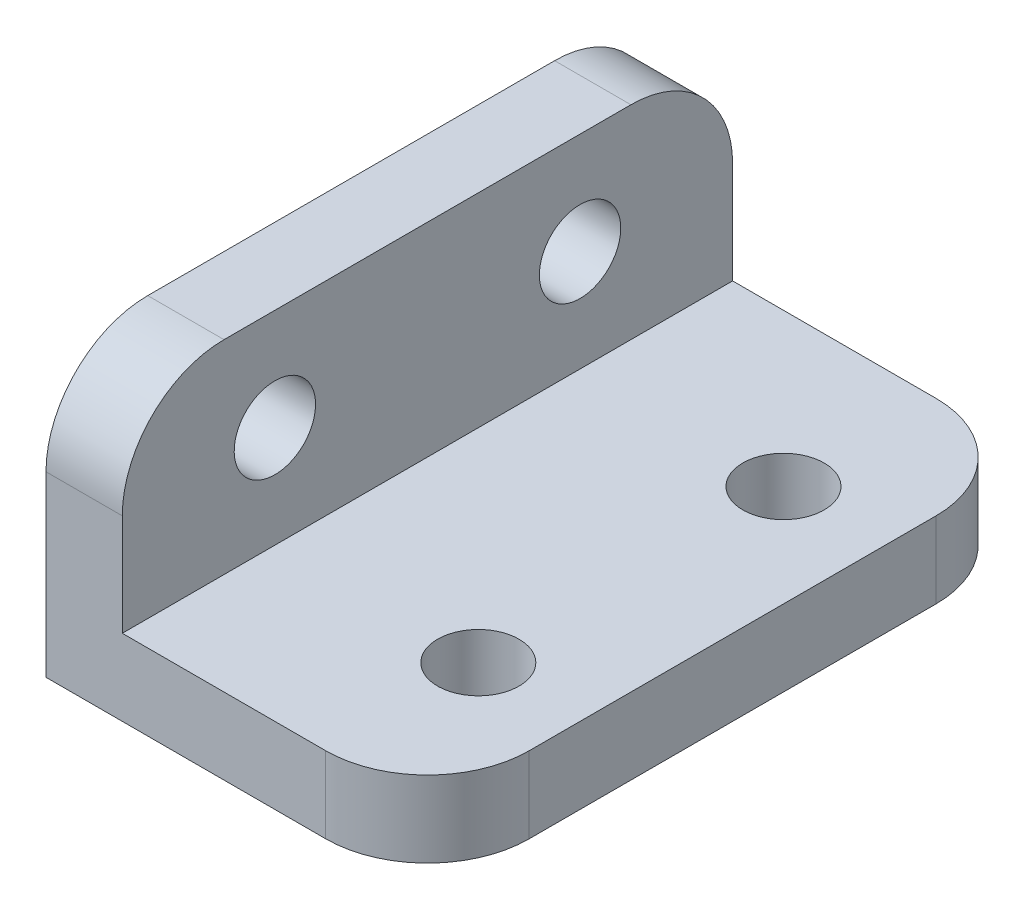
from build123d import *

# Parameters (mm, degrees)
EXTRUDE_1_DEPTH     = 24
SKETCH_2_R          = 1.6
CUT_EXTRUDE_1_DEPTH = 24
SKETCH_3_R          = 1.6
CUT_EXTRUDE_2_DEPTH = 24
FILLET_1_R          = 4


with BuildPart() as part:
    # 草图1 → 凸台-拉伸1 (new body)
    with BuildSketch(Plane.XY):
        Polygon((6, 112.691622655), (3, 112.691622655), (3, 101.691622655), (18, 101.691622655), (18, 104.691622655), (6, 104.691622655), align=None)
    extrude(amount=-EXTRUDE_1_DEPTH)

    # 草图2 → 切除-拉伸1 (cut)
    with BuildSketch(Plane(origin=(6, 0, 0), x_dir=(0, 0, -1), z_dir=(1, 0, 0))):
        with Locations(Location((6, 108.691622655, 0), (0, 0, 90))):
            Circle(SKETCH_2_R)
        with Locations(Location((18, 108.691622655, 0), (0, 0, 90))):
            Circle(SKETCH_2_R)
    extrude(amount=-CUT_EXTRUDE_1_DEPTH, mode=Mode.SUBTRACT)

    # 草图3 → 切除-拉伸2 (cut)
    with BuildSketch(Plane(origin=(0, 104.691622655, 0), x_dir=(1, 0, 0), z_dir=(0, 1, 0))):
        with Locations(Location((14, 6, 0), (0, 0, 180))):
            Circle(SKETCH_3_R)
        with Locations(Location((14, 18, 0), (0, 0, 180))):
            Circle(SKETCH_3_R)
    extrude(amount=-CUT_EXTRUDE_2_DEPTH, mode=Mode.SUBTRACT)

    # 圆角1
    fillet_1_edges = [part.edges().sort_by_distance(p)[0] for p in [
        (4.5, 112.691622655, -24),
        (4.5, 112.691622655, 0),
        (18, 103.191622655, -24),
        (18, 103.191622655, 0),
    ]]
    fillet(fillet_1_edges, radius=FILLET_1_R)


solid = part.part
